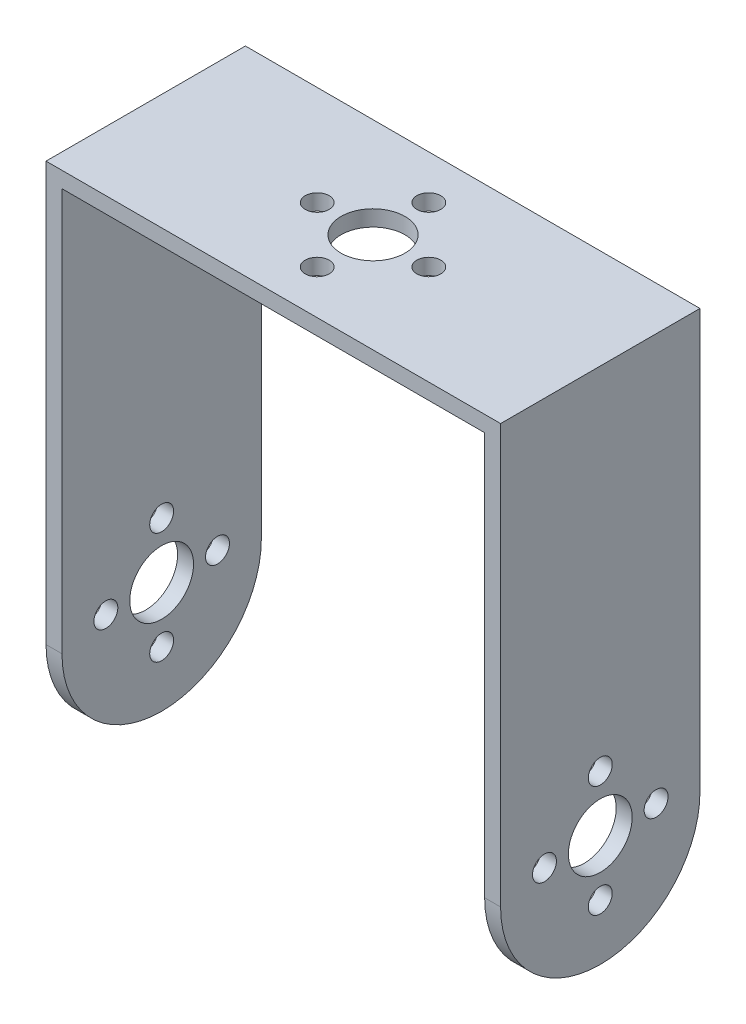
from build123d import *

# Parameters (mm, degrees)
BOSS_EXTRUDE2_DEPTH = 25
SKETCH4_R           = 4
CUT_EXTRUDE1_DEPTH  = 108.5257706
SKETCH6_R           = 4
CUT_EXTRUDE2_DEPTH  = 78.032036302
CUT_EXTRUDE3_DEPTH  = 78.032036302
SKETCH9_R           = 1.5
CUT_EXTRUDE4_DEPTH  = 78.032036302
SKETCH10_R          = 1.5
CUT_EXTRUDE5_DEPTH  = 108.5257706


with BuildPart() as part:
    # Sketch3 → Boss-Extrude2 (new body)
    with BuildSketch(Plane.XY):
        Polygon((-79.925523148, 45.386502584), (-27.042967192, 45.386502584), (-24.925523148, 45.386502584), (-24.925523148, -19.613497416), (-26.925523148, -19.613497416), (-26.925523148, 43.389953837), (-79.925523148, 43.389953837), (-79.925523148, -19.613497416), (-81.925523148, -19.613497416), (-81.925523148, 45.386502584), align=None)
    extrude(amount=BOSS_EXTRUDE2_DEPTH)

    # Sketch4 → Cut-Extrude1 (cut, through all)
    with BuildSketch(Plane(origin=(0, 45.386502584, 0), x_dir=(1, 0, 0), z_dir=(0, 1, 0))):
        with Locations(Location((-53.425523148, -12.5, 0), (0, 0, 270))):
            Circle(SKETCH4_R)
    extrude(amount=-CUT_EXTRUDE1_DEPTH, mode=Mode.SUBTRACT)

    # Sketch6 → Cut-Extrude2 (cut, through all)
    with BuildSketch(Plane.ZY.offset(81.925523148)):
        with Locations(Location((12.5, -5.613497416, 0), (0, 0, 270))):
            Circle(SKETCH6_R)
    extrude(amount=-CUT_EXTRUDE2_DEPTH, mode=Mode.SUBTRACT)

    # Sketch8 → Cut-Extrude3 (cut, through all)
    with BuildSketch(Plane.ZY.offset(81.925523148)):
        with BuildLine():
            Line((0, -19.613497416), (12.5, -19.613497416))
            ThreePointArc((12.5, -19.613497416), (3.661165213, -15.952332159), (0, -7.113497352))
            Line((0, -7.113497352), (0, -19.613497416))
        make_face()
        with BuildLine():
            Line((12.5, -19.613497416), (25, -19.613497416))
            Line((25, -19.613497416), (25, -7.113497416))
            ThreePointArc((25, -7.113497416), (21.338834765, -15.952332181), (12.5, -19.613497416))
        make_face()
    extrude(amount=-CUT_EXTRUDE3_DEPTH, mode=Mode.SUBTRACT)

    # Sketch9 → Cut-Extrude4 (cut, through all)
    with BuildSketch(Plane(origin=(-24.925523148, 0, 0), x_dir=(0, 0, -1), z_dir=(1, 0, 0))):
        with Locations(Location((-12.500004148, -12.613501564, 0), (0, 0, 90))):
            Circle(SKETCH9_R)
        with Locations(Location((-19.500008296, -5.613497416, 0), (0, 0, 90))):
            Circle(SKETCH9_R)
        with Locations(Location((-5.5, -5.613497416, 0), (0, 0, 90))):
            Circle(SKETCH9_R)
        with Locations(Location((-12.500004148, 1.386506731, 0), (0, 0, 90))):
            Circle(SKETCH9_R)
    extrude(amount=-CUT_EXTRUDE4_DEPTH, mode=Mode.SUBTRACT)

    # Sketch10 → Cut-Extrude5 (cut, through all)
    with BuildSketch(Plane(origin=(0, 45.386502584, 0), x_dir=(1, 0, 0), z_dir=(0, 1, 0))):
        with Locations(Location((-46.425523148, -12.499998866, 0), (0, 0, 270))):
            Circle(SKETCH10_R)
        with Locations(Location((-53.425523148, -5.499998866, 0), (0, 0, 270))):
            Circle(SKETCH10_R)
        with Locations(Location((-53.425523148, -19.499998866, 0), (0, 0, 270))):
            Circle(SKETCH10_R)
        with Locations(Location((-60.425523148, -12.499998866, 0), (0, 0, 270))):
            Circle(SKETCH10_R)
    extrude(amount=-CUT_EXTRUDE5_DEPTH, mode=Mode.SUBTRACT)


solid = part.part
